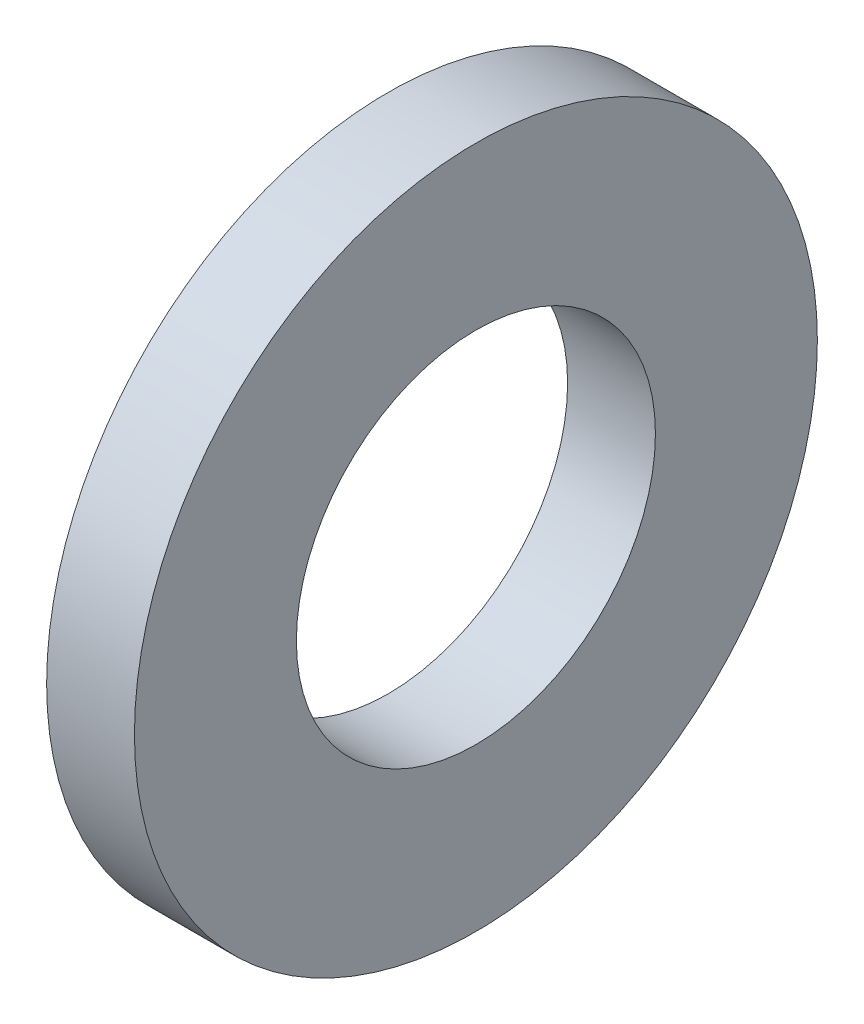
from build123d import *

# Parameters (mm, degrees)
SKETCH1_W = 0.9
SKETCH1_H = 1.66


with BuildPart() as part:
    # Sketch1 → Base-Revolve (revolve)
    with BuildSketch(Plane.XY, mode=Mode.PRIVATE) as base_revolve_sk:
        with Locations((-0.45, 2.67)):
            Rectangle(SKETCH1_W, SKETCH1_H)
    revolve(base_revolve_sk.sketch.rotate(Axis((-34.925, 0, 0), (1, 0, 0)), 90), axis=Axis((-34.925, 0, 0), (1, 0, 0)))


solid = part.part
